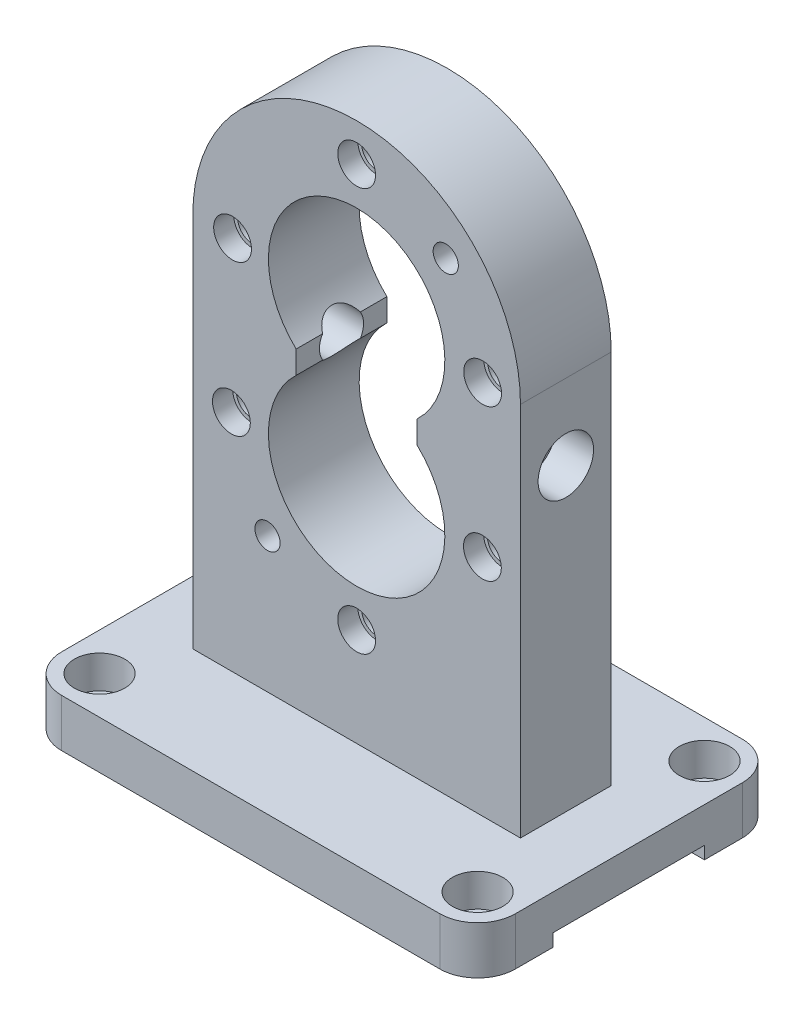
from build123d import *

# Parameters (mm, degrees)
BOSS_EXTRUDE1_DEPTH                      = 19
CBORE_FOR_M6_HEX_HEAD_BOLT1_D            = 15
CBORE_FOR_M6_HEX_HEAD_BOLT1_CBORE_D      = 20
CBORE_FOR_M6_HEX_HEAD_BOLT1_CBORE_DEPTH  = 13
BOSS_EXTRUDE2_DEPTH                      = 36
CUT_EXTRUDE1_DEPTH                       = 36
CBORE_FOR_M16_HEX_HEAD_BOLT1_D           = 17.5
CBORE_FOR_M16_HEX_HEAD_BOLT1_DEPTH       = 41
CBORE_FOR_M16_HEX_HEAD_BOLT1_CBORE_D     = 22
CBORE_FOR_M16_HEX_HEAD_BOLT1_CBORE_DEPTH = 15
CBORE_FOR_M5_HEX_HEAD_BOLT1_D            = 12
CBORE_FOR_M5_HEX_HEAD_BOLT1_CBORE_D      = 15
CBORE_FOR_M5_HEX_HEAD_BOLT1_CBORE_DEPTH  = 8
SKETCH9_W                                = 60
SKETCH9_H                                = 5
CUT_EXTRUDE2_DEPTH                       = 301.481280615
F_10_0MM_DOWEL_HOLE1_D                   = 10
F_10_0MM_DOWEL_HOLE1_DEPTH               = 36
F_10_0MM_DOWEL_HOLE1_TIP                 = 3.004303095
CUT_EXTRUDE3_START                       = -8
SKETCH12_R                               = 7.5
CUT_EXTRUDE3_DEPTH                       = 8


with BuildPart() as part:
    # Sketch1 → Boss-Extrude1 (new body)
    with BuildSketch(Plane(origin=(0, 0, 0), x_dir=(1, 0, 0), z_dir=(0, 1, 0))):
        with BuildLine():
            Line((-75, -60), (75, -60))
            ThreePointArc((75, -60), (85.606601718, -55.606601718), (90, -45))
            Line((90, -45), (90, 45))
            ThreePointArc((90, 45), (85.606601718, 55.606601718), (75, 60))
            Line((75, 60), (-75, 60))
            ThreePointArc((-75, 60), (-85.606601718, 55.606601718), (-90, 45))
            Line((-90, 45), (-90, -45))
            ThreePointArc((-90, -45), (-85.606601718, -55.606601718), (-75, -60))
        make_face()
    extrude(amount=BOSS_EXTRUDE1_DEPTH)

    # CBORE for M6 Hex Head Bolt1 (through all)
    with Locations(Plane(origin=(-75, 19, 45), x_dir=(0, 0, 1), z_dir=(0, 1, 0))):
        with Locations((0, 0), (-90, 0), (-90, 150), (0, 150)):
            CounterBoreHole(CBORE_FOR_M6_HEX_HEAD_BOLT1_D / 2, CBORE_FOR_M6_HEX_HEAD_BOLT1_CBORE_D / 2, CBORE_FOR_M6_HEX_HEAD_BOLT1_CBORE_DEPTH)

    # Sketch3 → Boss-Extrude2 (add)
    with BuildSketch(Plane.XY.offset(18)):
        with BuildLine():
            Line((-65, 168), (-65, 0))
            Line((-65, 0), (65, 0))
            Line((65, 0), (65, 168))
            ThreePointArc((65, 168), (0, 233), (-65, 168))
        make_face()
    extrude(amount=-BOSS_EXTRUDE2_DEPTH)

    # Sketch4 → Cut-Extrude1 (cut)
    with BuildSketch(Plane.XY.offset(18)):
        with BuildLine():
            Line((24, 142.524521594), (24, 133.475478406))
            ThreePointArc((24, 133.475478406), (0, 73), (-24, 133.475478406))
            Line((-24, 133.475478406), (-24, 142.524521594))
            ThreePointArc((-24, 142.524521594), (0, 203), (24, 142.524521594))
        make_face()
    extrude(amount=-CUT_EXTRUDE1_DEPTH, mode=Mode.SUBTRACT)

    # CBORE for M16 Hex Head Bolt1
    with Locations(Plane(origin=(65, 138, 0), x_dir=(0, 1, 0), z_dir=(1, 0, 0))):
        with Locations((0, 0)):
            cbore_for_m16_hex_head_bolt1 = CounterBoreHole(CBORE_FOR_M16_HEX_HEAD_BOLT1_D / 2, CBORE_FOR_M16_HEX_HEAD_BOLT1_CBORE_D / 2, CBORE_FOR_M16_HEX_HEAD_BOLT1_CBORE_DEPTH, depth=CBORE_FOR_M16_HEX_HEAD_BOLT1_DEPTH)

    # Mirror1: CBORE for M16 Hex Head Bolt1 across plane
    add(cbore_for_m16_hex_head_bolt1.mirror(Plane(origin=(0, 0, 0), x_dir=(0, 0, 1), z_dir=(1, 0, 0))), mode=Mode.SUBTRACT)

    # CBORE for M5 Hex Head Bolt1 (through all)
    with Locations(Plane(origin=(0, 218, 18), x_dir=(1, 0, 0), z_dir=(0, 0, 1))):
        with Locations((0, 0), (-49.225256247, -50), (-49.687709551, -110), (0, -160), (49.897824361, -110), (49.991173273, -50)):
            CounterBoreHole(CBORE_FOR_M5_HEX_HEAD_BOLT1_D / 2, CBORE_FOR_M5_HEX_HEAD_BOLT1_CBORE_D / 2, CBORE_FOR_M5_HEX_HEAD_BOLT1_CBORE_DEPTH)

    # Sketch9 → Cut-Extrude2 (cut, through all)
    with BuildSketch(Plane(origin=(90, 0, 0), x_dir=(0, 0, -1), z_dir=(1, 0, 0))):
        with Locations((0, 2.5)):
            Rectangle(SKETCH9_W, SKETCH9_H)
    extrude(amount=-CUT_EXTRUDE2_DEPTH, mode=Mode.SUBTRACT)

    # Ø10.0mm Dowel Hole1
    with Locations(Plane(origin=(35.355339059, 203.355339059, 18), x_dir=(1, 0, 0), z_dir=(0, 0, 1))):
        with Locations((0, 0), (-70.710678118, -130.710678118)):
            Hole(F_10_0MM_DOWEL_HOLE1_D / 2, depth=F_10_0MM_DOWEL_HOLE1_DEPTH)
            with Locations((0, 0, -(F_10_0MM_DOWEL_HOLE1_DEPTH + F_10_0MM_DOWEL_HOLE1_TIP / 2))):  # 118° drill point
                Cone(0, F_10_0MM_DOWEL_HOLE1_D / 2, F_10_0MM_DOWEL_HOLE1_TIP, mode=Mode.SUBTRACT)

    # Sketch12 → Cut-Extrude3 (cut)
    with BuildSketch(Plane(origin=(0, 0, -18), x_dir=(-1, 0, 0), z_dir=(0, 0, -1)).offset(CUT_EXTRUDE3_START)):
        with Locations(Location((0, 218, 0), (0, 0, 180))):
            Circle(SKETCH12_R)
        with Locations(Location((-49.991173273, 168, 0), (0, 0, 180))):
            Circle(SKETCH12_R)
        with Locations(Location((-49.897824361, 108, 0), (0, 0, 180))):
            Circle(SKETCH12_R)
        with Locations(Location((49.687709551, 108, 0), (0, 0, 180))):
            Circle(SKETCH12_R)
        with Locations(Location((49.225256247, 168, 0), (0, 0, 180))):
            Circle(SKETCH12_R)
        with Locations(Location((0, 58, 0), (0, 0, 180))):
            Circle(SKETCH12_R)
    extrude(amount=CUT_EXTRUDE3_DEPTH, mode=Mode.SUBTRACT)


solid = part.part
